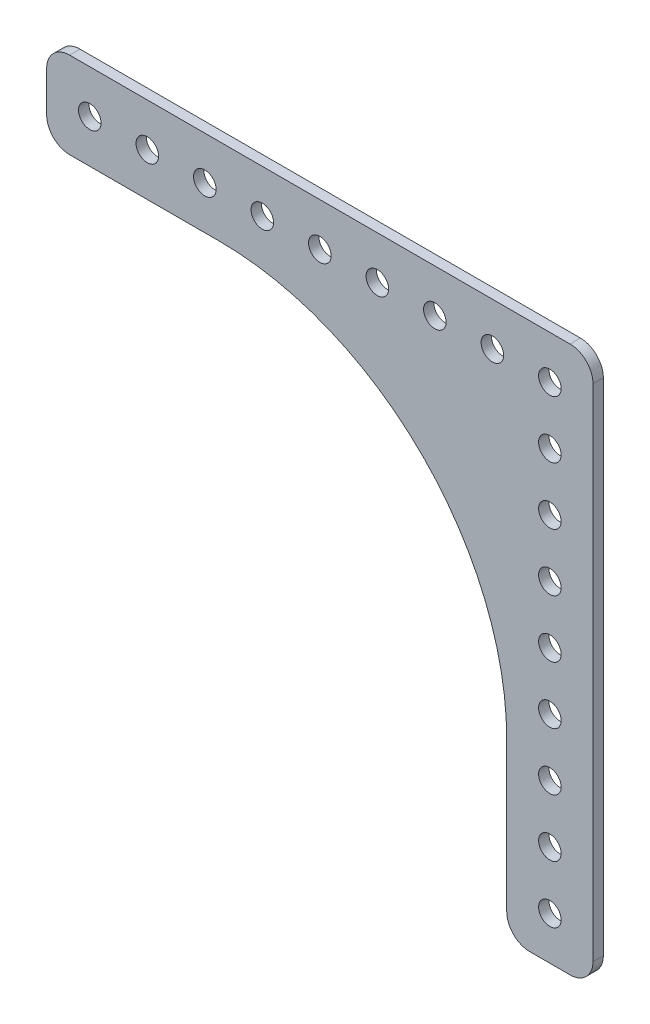
from build123d import *

# Parameters (mm, degrees)
SKETCH1_R           = 2.4892
BOSS_EXTRUDE1_DEPTH = 2.286


with BuildPart() as part:
    # Sketch1 → Boss-Extrude1 (new body)
    with BuildSketch(Plane.XY):
        with BuildLine():
            Line((459.749472964, 373.657281044), (426.729472964, 373.657281044))
            ThreePointArc((426.729472964, 373.657281044), (423.137370515, 375.145178596), (421.649472964, 378.737281044))
            Line((421.649472964, 378.737281044), (421.649472964, 387.627281044))
            ThreePointArc((421.649472964, 387.627281044), (423.137370515, 391.219383493), (426.729472964, 392.707281044))
            Line((426.729472964, 392.707281044), (537.219472964, 392.707281044))
            ThreePointArc((537.219472964, 392.707281044), (540.811575412, 391.219383493), (542.299472964, 387.627281044))
            Line((542.299472964, 387.627281044), (542.299472964, 277.137281044))
            ThreePointArc((542.299472964, 277.137281044), (540.811575412, 273.545178596), (537.219472964, 272.057281044))
            Line((537.219472964, 272.057281044), (528.329472964, 272.057281044))
            ThreePointArc((528.329472964, 272.057281044), (524.737370515, 273.545178596), (523.249472964, 277.137281044))
            Line((523.249472964, 277.137281044), (523.249472964, 310.157281044))
            ThreePointArc((523.249472964, 310.157281044), (504.650753569, 355.05856165), (459.749472964, 373.657281044))
        make_face()
        with Locations((431.174472964, 383.182281044)):
            Circle(SKETCH1_R, mode=Mode.SUBTRACT)
        with Locations((443.874472964, 383.182281044)):
            Circle(SKETCH1_R, mode=Mode.SUBTRACT)
        with Locations((456.574472964, 383.182281044)):
            Circle(SKETCH1_R, mode=Mode.SUBTRACT)
        with Locations((469.274472964, 383.182281044)):
            Circle(SKETCH1_R, mode=Mode.SUBTRACT)
        with Locations((481.974472964, 383.182281044)):
            Circle(SKETCH1_R, mode=Mode.SUBTRACT)
        with Locations((494.674472964, 383.182281044)):
            Circle(SKETCH1_R, mode=Mode.SUBTRACT)
        with Locations((507.374472964, 383.182281044)):
            Circle(SKETCH1_R, mode=Mode.SUBTRACT)
        with Locations((520.074472964, 383.182281044)):
            Circle(SKETCH1_R, mode=Mode.SUBTRACT)
        with Locations((532.774472964, 383.182281044)):
            Circle(SKETCH1_R, mode=Mode.SUBTRACT)
        with Locations((532.774472964, 370.482281044)):
            Circle(SKETCH1_R, mode=Mode.SUBTRACT)
        with Locations((532.774472964, 357.782281044)):
            Circle(SKETCH1_R, mode=Mode.SUBTRACT)
        with Locations((532.774472964, 345.082281044)):
            Circle(SKETCH1_R, mode=Mode.SUBTRACT)
        with Locations((532.774472964, 332.382281044)):
            Circle(SKETCH1_R, mode=Mode.SUBTRACT)
        with Locations((532.774472964, 319.682281044)):
            Circle(SKETCH1_R, mode=Mode.SUBTRACT)
        with Locations((532.774472964, 306.982281044)):
            Circle(SKETCH1_R, mode=Mode.SUBTRACT)
        with Locations((532.774472964, 294.282281044)):
            Circle(SKETCH1_R, mode=Mode.SUBTRACT)
        with Locations((532.774472964, 281.582281044)):
            Circle(SKETCH1_R, mode=Mode.SUBTRACT)
    extrude(amount=BOSS_EXTRUDE1_DEPTH)


solid = part.part
